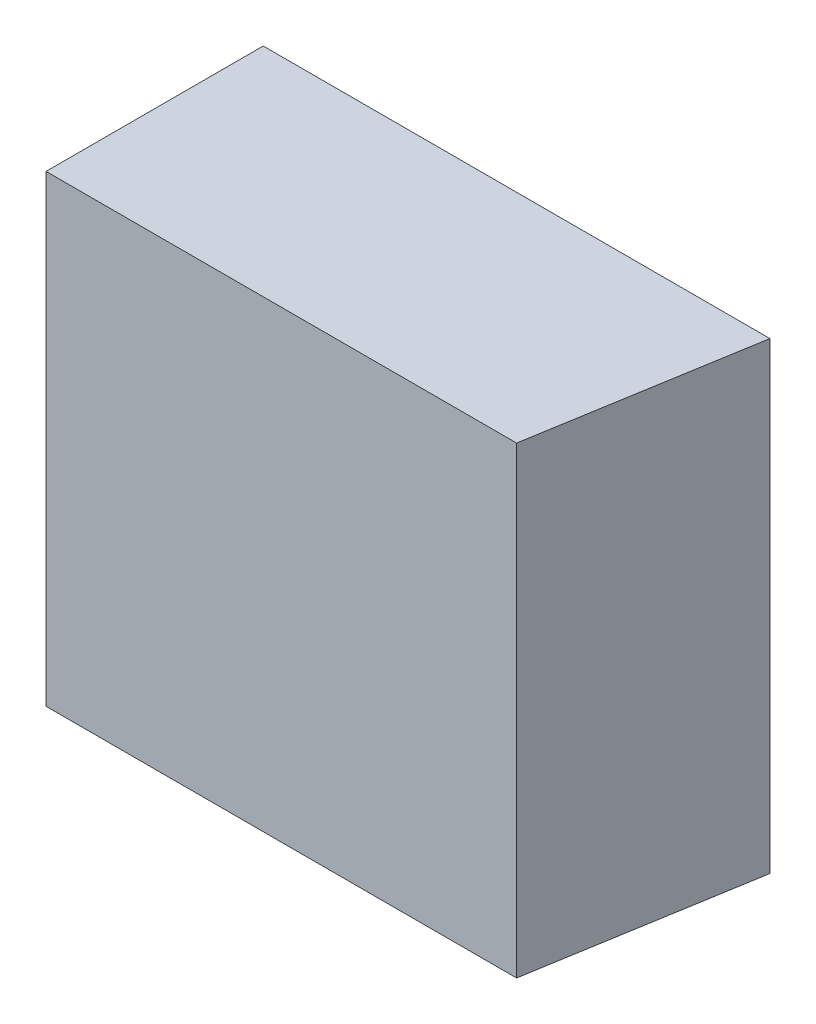
from build123d import *

# Parameters (mm, degrees)
EXTRUDE_2_DEPTH = 160
SHELL_2_T       = -4


with BuildPart() as part:
    # 草图1 → 凸台-拉伸2 (new, symmetric)
    with BuildSketch(Plane(origin=(0, 0, 0), x_dir=(1, 0, 0), z_dir=(0, 1, 0))):
        Polygon((200, 0), (0, 0), (-150, 0), (-150, -150), (175, -150), align=None)
    extrude(amount=EXTRUDE_2_DEPTH, both=True)

    # 抽壳2
    shell_2_openings = [part.faces().sort_by_distance(p)[0] for p in [
        (25, 0, 0),
    ]]
    offset(amount=SHELL_2_T, openings=shell_2_openings, kind=Kind.INTERSECTION)


solid = part.part
